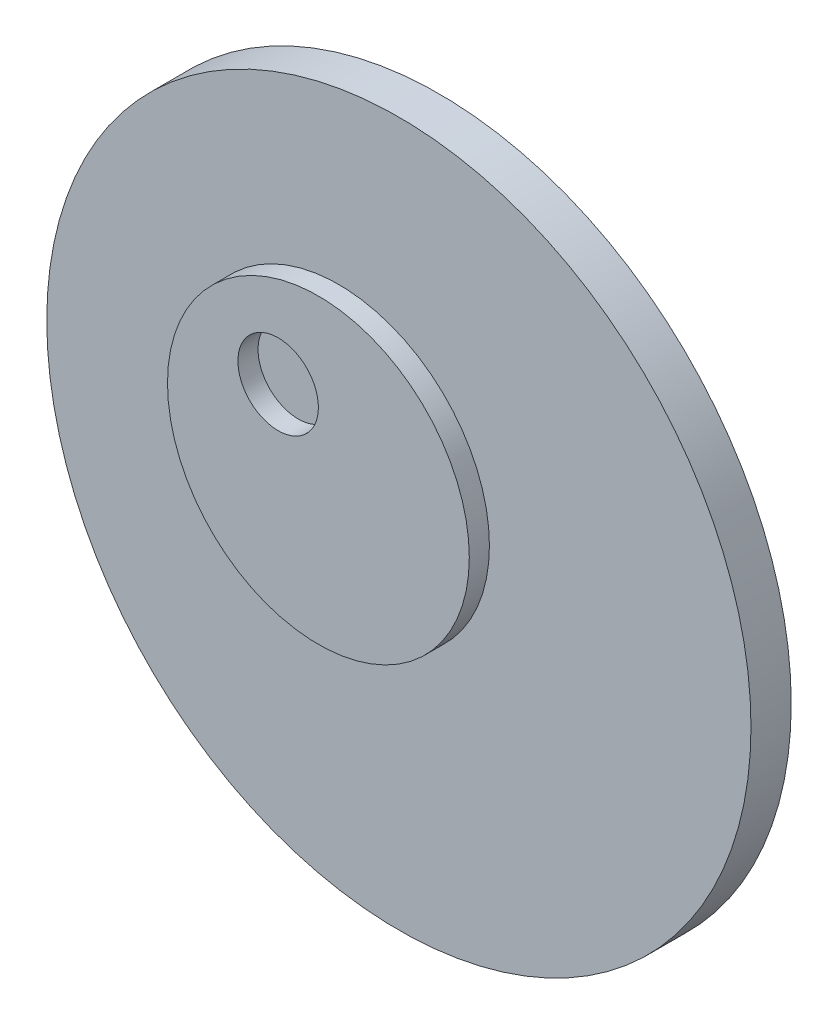
from build123d import *

# Parameters (mm, degrees)
SKETCH1_R           = 17.5
BOSS_EXTRUDE1_DEPTH = 2
SKETCH2_R           = 7.5
SKETCH2_R_2         = 2
BOSS_EXTRUDE2_DEPTH = 1


with BuildPart() as part:
    # Sketch1 → Boss-Extrude1 (new body)
    with BuildSketch(Plane.XY):
        Circle(SKETCH1_R)
    extrude(amount=BOSS_EXTRUDE1_DEPTH)


with BuildPart() as body_2:
    # Sketch2 → Boss-Extrude2 (new body)
    with BuildSketch(Plane.XY.offset(2)):
        with Locations((-3, 1.3)):
            Circle(SKETCH2_R)
        with Locations((-5, 4)):
            Circle(SKETCH2_R_2, mode=Mode.SUBTRACT)
    extrude(amount=BOSS_EXTRUDE2_DEPTH)


solid = Compound([part.part, body_2.part])
